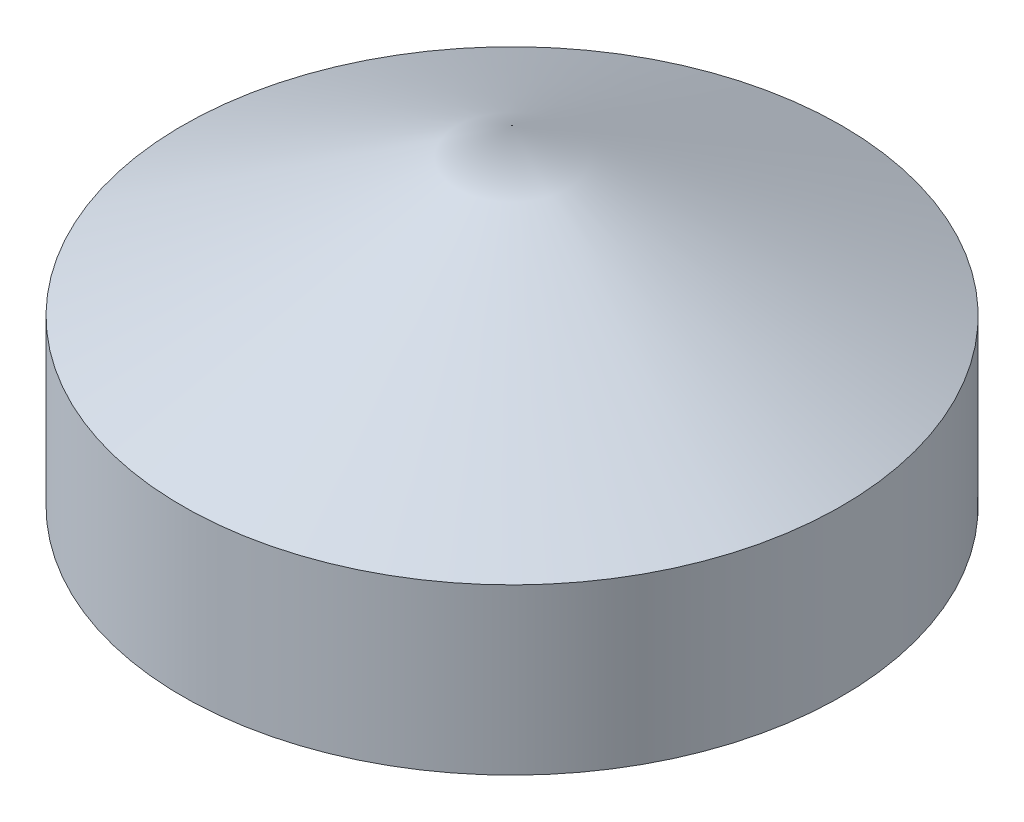
from build123d import *


with BuildPart() as part:
    # Sketch1 → Revolve1 (revolve)
    with BuildSketch(Plane.XY, mode=Mode.PRIVATE) as revolve1_sk:
        Polygon((0, 0), (10, 0), (10, 5), (0, 10), align=None)
    revolve(revolve1_sk.sketch.rotate(Axis((0, 0, 0), (0, 1, 0)), 90), axis=Axis((0, 0, 0), (0, 1, 0)))


solid = part.part
